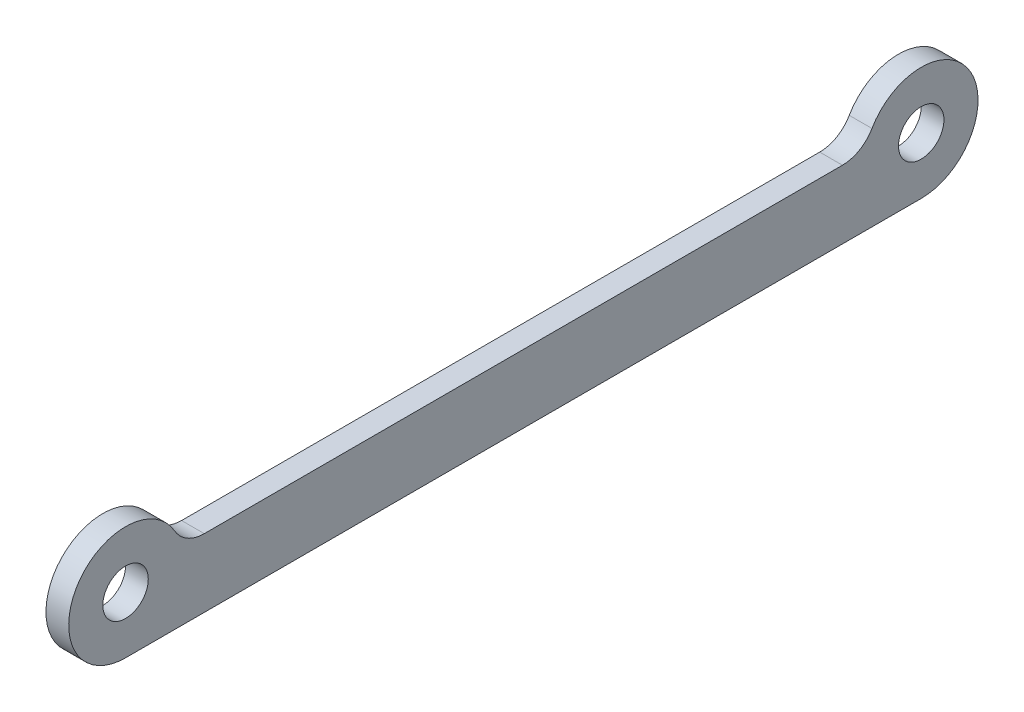
from build123d import *

# Parameters (mm, degrees)
SKETCH_1_R          = 5
SKETCH_1_W          = 70
SKETCH_1_H          = 6
EXTRUDE_1_DEPTH     = 2
SKETCH_1_3_R        = 2
CUT_EXTRUDE_1_DEPTH = 76.266194271
FILLET_1_R          = 3


with BuildPart() as part:
    # 草图1 → 凸台-拉伸1 (new body)
    with BuildSketch(Plane(origin=(0, 0, 0), x_dir=(0, 0, -1), z_dir=(1, 0, 0))):
        with Locations((70, -1)):
            Circle(SKETCH_1_R)
        with Locations((0, -1)):
            Circle(SKETCH_1_R)
        with Locations((35, -3)):
            Rectangle(SKETCH_1_W, SKETCH_1_H)
    extrude(amount=EXTRUDE_1_DEPTH)

    # 草图1<3> → 切除-拉伸1 (cut, through all)
    with BuildSketch(Plane(origin=(0, 0, 0), x_dir=(0, 0, -1), z_dir=(1, 0, 0))):
        with Locations((70, -1)):
            Circle(SKETCH_1_3_R)
        with Locations((0, -1)):
            Circle(SKETCH_1_3_R)
    extrude(amount=CUT_EXTRUDE_1_DEPTH, mode=Mode.SUBTRACT)

    # 圆角1
    fillet_1_edges = [part.edges().sort_by_distance(p)[0] for p in [
        (1, 0, -65.101020514),
        (1, 0, -4.898979486),
    ]]
    fillet(fillet_1_edges, radius=FILLET_1_R)


solid = part.part
